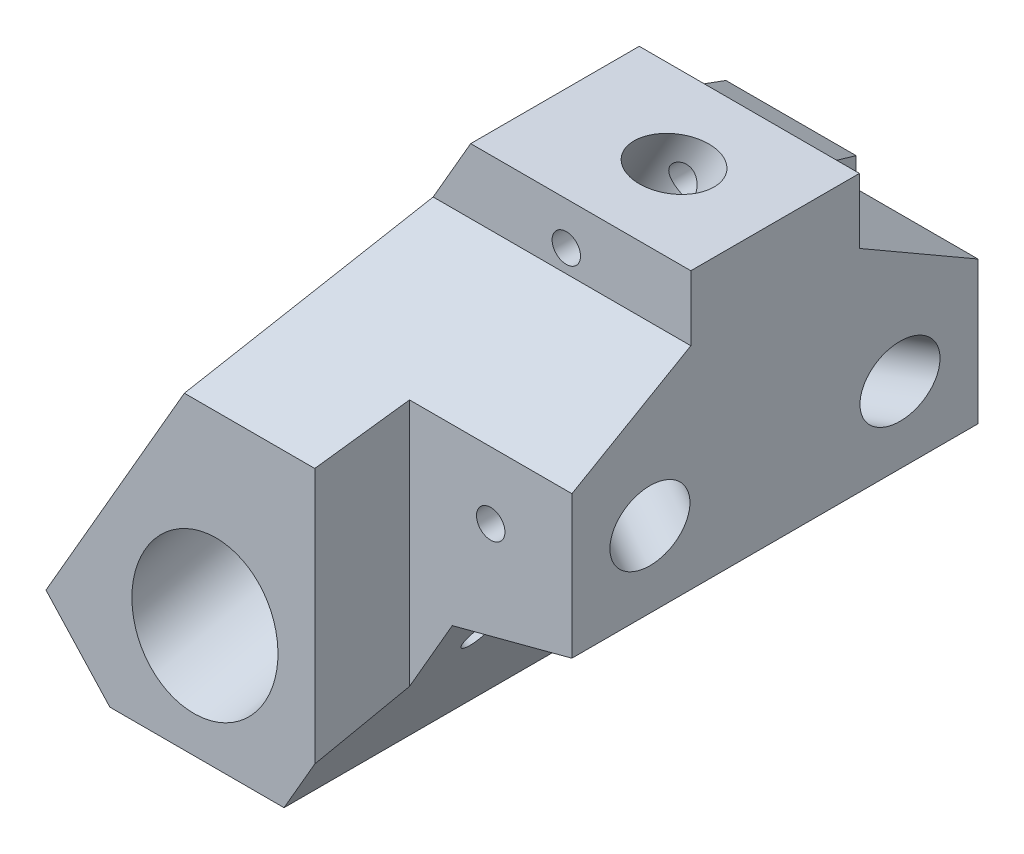
from build123d import *

# Parameters (mm, degrees)
BOSS_EXTRUDE1_DEPTH      = 37
BOSS_EXTRUDE1_DEPTH_BACK = 52
CUT_EXTRUDE5_REACH       = 108.479
SKETCH11_R               = 6.4
SKETCH12_R               = 6.4
CUT_EXTRUDE6_DEPTH       = 107.479320653
SKETCH14_R               = 12.9
CUT_EXTRUDE8_DEPTH       = 96.517571793
SKETCH15_R               = 12.9
CUT_EXTRUDE9_DEPTH       = 96.055320399
SKETCH16_R               = 2.625
CUT_EXTRUDE10_DEPTH      = 128.687117596
SKETCH13_R               = 6.4
CUT_EXTRUDE15_DEPTH      = 103.003266712
CUT_EXTRUDE16_DEPTH      = 128.687117596
CUT_EXTRUDE17_DEPTH      = 125.149710579
CUT_EXTRUDE25_DEPTH      = 117.949180331
SKETCH31_R               = 2.625
CUT_EXTRUDE22_DEPTH      = 103.253619099
CUT_EXTRUDE26_DEPTH      = 125.149710659
SKETCH36_R               = 2.625
CUT_EXTRUDE27_DEPTH      = 95.867859136


with BuildPart() as part:
    # Sketch9 → Boss-Extrude1 (new, two sides: drawn at the far end of the back side and taken through both)
    with BuildSketch(Plane(origin=(0, 0, 0), x_dir=(1, 0, 0), z_dir=(0, 1, 0)).offset(-BOSS_EXTRUDE1_DEPTH_BACK)):
        Polygon((-5, 50), (5, 50), (10, 37.5), (40, 37.5), (40, -37.5), (10, -37.5), (5, -50), (-5, -50), (-60, -50), (-60, 50), align=None)
    extrude(amount=BOSS_EXTRUDE1_DEPTH + BOSS_EXTRUDE1_DEPTH_BACK)

    # Cut-Extrude5: up to this plane
    cut_extrude5_end = Plane(origin=(40, -52, 37.5), z_dir=(1, 0, 0))
    # Sketch11 → Cut-Extrude5 (cut, up to the surface)
    with BuildSketch(Plane(origin=(12.990381057, 0, -7.5), x_dir=(-0.5000000000000013, 0, -0.8660254037844379), z_dir=(0.8660254037844379, 0, -0.5000000000000013)), mode=Mode.PRIVATE) as cut_extrude5_sk1:
        with Locations(Location((0, 0, 0), (0, 0, 180))):
            Circle(SKETCH11_R)
    cut_extrude5_tool1 = split(extrude(cut_extrude5_sk1.sketch, amount=CUT_EXTRUDE5_REACH, mode=Mode.PRIVATE), bisect_by=cut_extrude5_end, keep=Keep.BOTH, mode=Mode.PRIVATE)
    add(cut_extrude5_tool1.solids().sort_by_distance((12.990381, 0, -7.5))[0], mode=Mode.SUBTRACT)

    # Sketch12 → Cut-Extrude6 (cut, through all)
    with BuildSketch(Plane(origin=(12.990381057, 0, 7.5), x_dir=(0.5000000000000009, 0, -0.866025403784438), z_dir=(0.8660254037844382, 0, 0.500000000000001))):
        Circle(SKETCH12_R)
    extrude(amount=CUT_EXTRUDE6_DEPTH, mode=Mode.SUBTRACT)

    # Sketch14 → Cut-Extrude8 (cut, through all)
    with BuildSketch(Plane(origin=(-3.229283171, -7.476383099, -12.59664344), x_dir=(-0.9697475532809772, 0.007782671596180618, 0.24398588674016475), z_dir=(-0.21528554474375752, -0.49842553993010197, -0.8397762293431328))):
        with Locations(Location((0, 0, 0), (0, 0, 116.704243504))):
            Circle(SKETCH14_R)
    extrude(amount=CUT_EXTRUDE8_DEPTH, mode=Mode.SUBTRACT)

    # Sketch15 → Cut-Extrude9 (cut, through all)
    with BuildSketch(Plane(origin=(-3.798019855, -7.5, 12.422763186), x_dir=(-0.9674136083951571, 0.13086508264944213, -0.2167607908156276), z_dir=(0.2532013236376571, 0.49999999999999495, -0.8281842124238686))):
        with Locations(Location((0, 0, 0), (0, 0, 90))):
            Circle(SKETCH15_R)
    extrude(amount=-CUT_EXTRUDE9_DEPTH, mode=Mode.SUBTRACT)

    # Sketch16 → Cut-Extrude10 (cut, through all)
    with BuildSketch(Plane(origin=(0, 0, -50), x_dir=(-1, 0, 0), z_dir=(0, 0, -1))):
        with Locations((-25, 0)):
            Circle(SKETCH16_R)
    extrude(amount=-CUT_EXTRUDE10_DEPTH, mode=Mode.SUBTRACT)

    # Sketch13 → Cut-Extrude15 (cut, through all)
    with BuildSketch(Plane(origin=(5, 8.660254038, 0), x_dir=(0.8581606322585569, -0.49545927204241474, -0.1344635228929922), z_dir=(0.49999999999999806, 0.8660254037844397, 0))):
        with Locations(Location((0, 0, 0), (0, 0, 172.272400829))):
            Circle(SKETCH13_R)
    extrude(amount=CUT_EXTRUDE15_DEPTH, mode=Mode.SUBTRACT)

    # Sketch25 → Cut-Extrude16 (cut, through all)
    with BuildSketch(Plane.XY.offset(50)):
        Polygon((-60, -65.770666842), (-0.665327834, 37), (-60, 37), align=None)
    extrude(amount=-CUT_EXTRUDE16_DEPTH, mode=Mode.SUBTRACT)

    # Sketch26 → Cut-Extrude17 (cut, through all)
    with BuildSketch(Plane(origin=(0, 0, -50), x_dir=(-1, 0, 0), z_dir=(0, 0, -1))):
        Polygon((-40, -14), (-17.898055975, -19.831365478), (0.674513826, -52), (-40, -52), align=None)
    extrude(amount=-CUT_EXTRUDE17_DEPTH, mode=Mode.SUBTRACT)

    # Sketch27 → Cut-Extrude25 (cut, through all)
    with BuildSketch(Plane.ZY.offset(-40)):
        Polygon((-50, 37), (-15.598651273, 37), (-15.598651273, 25), (-50, 5.138372052), align=None)
        Polygon((15.537544719, 37), (15.537544719, 25), (50, 5.103092167), (50, 37), align=None)
    extrude(amount=CUT_EXTRUDE25_DEPTH, mode=Mode.SUBTRACT)

    # Sketch31 → Cut-Extrude22 (cut, through all)
    with BuildSketch(Plane(origin=(22.010775129, -12.707926946, 0), x_dir=(0, 0, -1), z_dir=(0.8660254037844397, -0.4999999999999981, 0))):
        with Locations(Location((-27.712190923, -18.725438309, 0), (0, 0, 90))):
            Circle(SKETCH31_R)
        with Locations(Location((29.158933157, -18.725438309, 0), (0, 0, 90))):
            Circle(SKETCH31_R)
    extrude(amount=-CUT_EXTRUDE22_DEPTH, mode=Mode.SUBTRACT)

    # Sketch35 → Cut-Extrude26 (cut, through all)
    with BuildSketch(Plane(origin=(0, 0, -50), x_dir=(-1, 0, 0), z_dir=(0, 0, -1))):
        Polygon((44.639977993, -39.16632832), (25.461488573, -60.033808877), (52.049501792, -52), align=None)
    extrude(amount=-CUT_EXTRUDE26_DEPTH, mode=Mode.SUBTRACT)

    # Sketch36 → Cut-Extrude27 (cut, through all)
    with BuildSketch(Plane(origin=(0, 0, -15.598651273), x_dir=(-1, 0, 0), z_dir=(0, 0, -1))):
        with Locations((-17, 29.136428333)):
            Circle(SKETCH36_R)
    extrude(amount=-CUT_EXTRUDE27_DEPTH, mode=Mode.SUBTRACT)


solid = part.part
